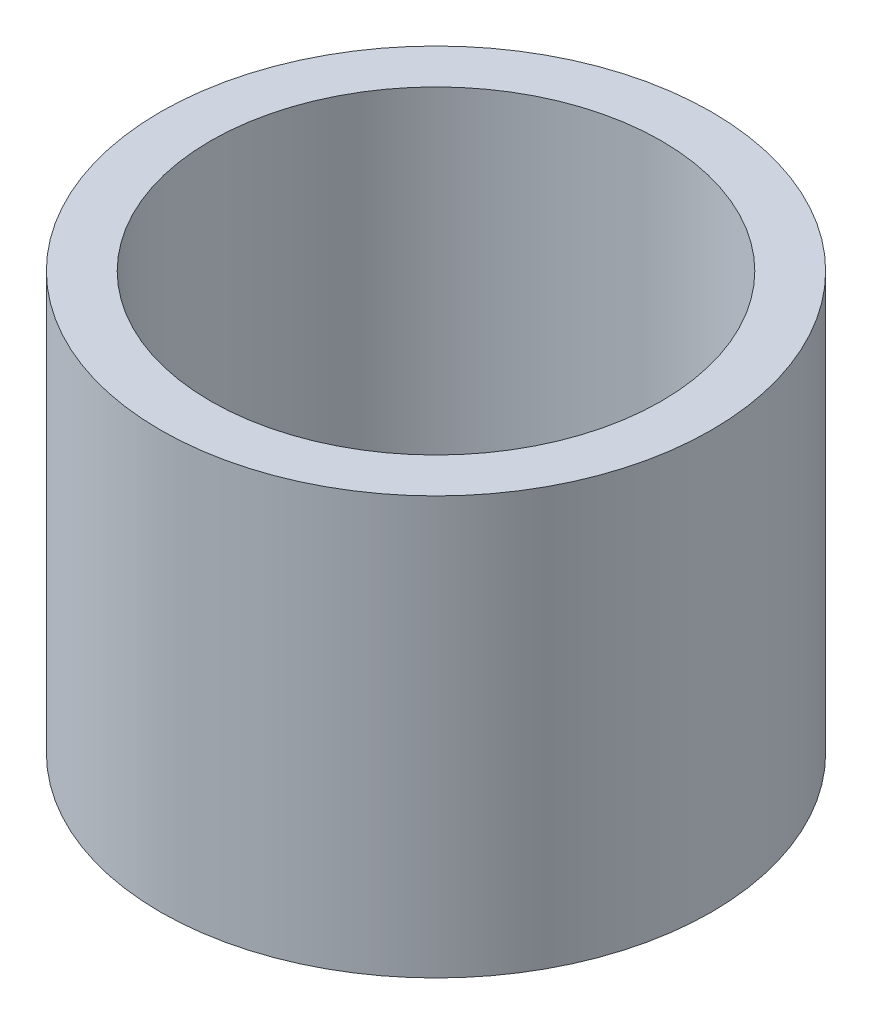
from build123d import *

# Parameters (mm, degrees)
SKETCH1_R           = 16.5
SKETCH1_R_2         = 13.5
BOSS_EXTRUDE1_DEPTH = 25


with BuildPart() as part:
    # Sketch1 → Boss-Extrude1 (new body)
    with BuildSketch(Plane(origin=(0, 0, 0), x_dir=(1, 0, 0), z_dir=(0, 1, 0))):
        with Locations(Location((0, 0, 0), (0, 0, 270))):
            Circle(SKETCH1_R)
        with Locations(Location((0, 0, 0), (0, 0, 270))):
            Circle(SKETCH1_R_2, mode=Mode.SUBTRACT)
    extrude(amount=BOSS_EXTRUDE1_DEPTH)


solid = part.part
